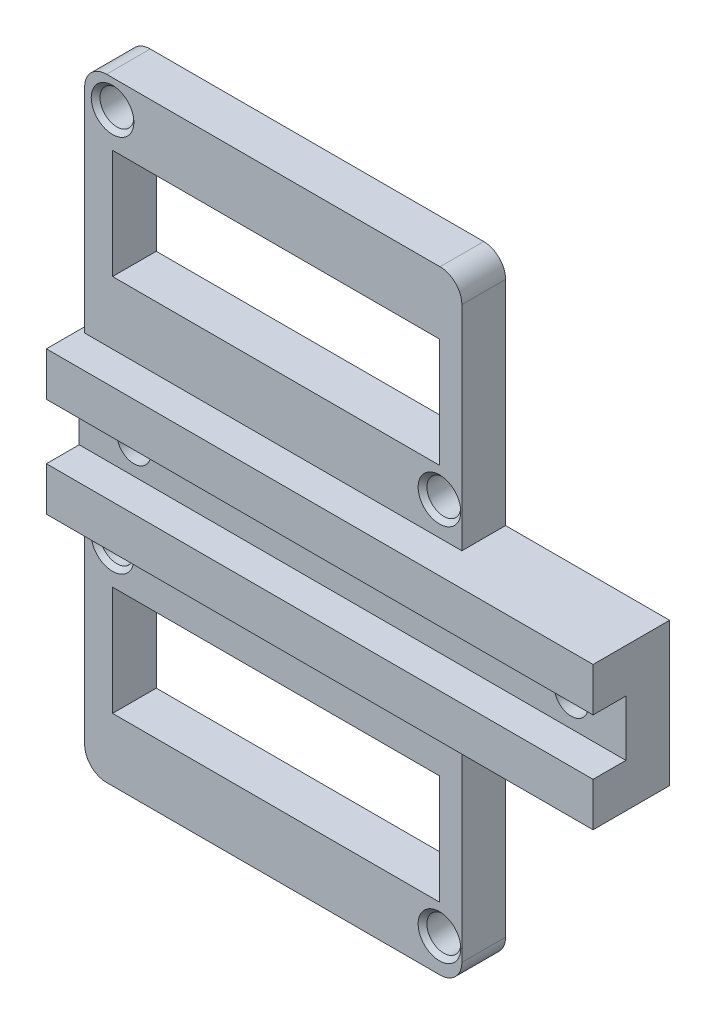
from build123d import *

# Parameters (mm, degrees)
CROQUIS1_R              = 1.55
SALIENTE_EXTRUIR1_DEPTH = 4
CROQUIS2_W              = 50
CROQUIS2_H              = 4
SALIENTE_EXTRUIR2_DEPTH = 7
SALIENTE_EXTRUIR3_START = -7
CROQUIS3_W              = 34.5
CROQUIS3_H              = 21.5
CROQUIS3_R              = 1.55
CROQUIS3_W_2            = 29.9
CROQUIS3_H_2            = 10
SALIENTE_EXTRUIR3_DEPTH = 4
REDONDEO1_R             = 2
CHAFL_N1_SIZE           = 0.4


with BuildPart() as part:
    # Croquis1 → Saliente-Extruir1 (new body)
    # profile 1 of 3: a face of its own
    with BuildSketch(Plane.XY):
        with BuildLine():
            ThreePointArc((-20, 2.55), (-22.55, 0), (-20, -2.55))
            Line((-20, -2.55), (-25, -2.55))
            Line((-25, -2.55), (-25, 2.55))
            Line((-25, 2.55), (-20, 2.55))
        make_face()
    # profile 2 of 3: a face of its own
    with BuildSketch(Plane.XY):
        with BuildLine():
            Line((-20, -2.55), (20, -2.55))
            ThreePointArc((20, -2.55), (22.55, 0), (20, 2.55))
            Line((20, 2.55), (-20, 2.55))
            ThreePointArc((-20, 2.55), (-22.55, 0), (-20, -2.55))
        make_face()
        with Locations((-20, 0)):
            Circle(CROQUIS1_R, mode=Mode.SUBTRACT)
        with Locations((20, 0)):
            Circle(CROQUIS1_R, mode=Mode.SUBTRACT)
    # profile 3 of 3: a face of its own
    with BuildSketch(Plane.XY):
        with BuildLine():
            ThreePointArc((20, -2.55), (22.55, 0), (20, 2.55))
            Line((20, 2.55), (25, 2.55))
            Line((25, 2.55), (25, -2.55))
            Line((25, -2.55), (20, -2.55))
        make_face()
    extrude(amount=SALIENTE_EXTRUIR1_DEPTH)

    # Croquis2 → Saliente-Extruir2 (add)
    with BuildSketch(Plane.XY):
        with Locations((0, 4.55)):
            Rectangle(CROQUIS2_W, CROQUIS2_H)
        with Locations((0, -4.55)):
            Rectangle(CROQUIS2_W, CROQUIS2_H)
    extrude(amount=SALIENTE_EXTRUIR2_DEPTH)

    # Croquis3 → Saliente-Extruir3 (add)
    # profile 1 of 2: a face of its own
    with BuildSketch(Plane.XY.offset(7).offset(SALIENTE_EXTRUIR3_START)):
        with Locations((-7.25, 17.3)):
            Rectangle(CROQUIS3_W, CROQUIS3_H)
        with Locations((-21.95, 25.5)):
            Circle(CROQUIS3_R, mode=Mode.SUBTRACT)
        with Locations((7.95, 9.6)):
            Circle(CROQUIS3_R, mode=Mode.SUBTRACT)
        with Locations((-7, 17.3)):
            Rectangle(CROQUIS3_W_2, CROQUIS3_H_2, mode=Mode.SUBTRACT)
    # profile 2 of 2: a face of its own
    with BuildSketch(Plane.XY.offset(7).offset(SALIENTE_EXTRUIR3_START)):
        with Locations((-7.25, -17.3)):
            Rectangle(CROQUIS3_W, CROQUIS3_H)
        with Locations((-21.95, -9.1)):
            Circle(CROQUIS3_R, mode=Mode.SUBTRACT)
        with Locations((-7, -17.3)):
            Rectangle(CROQUIS3_W_2, CROQUIS3_H_2, mode=Mode.SUBTRACT)
        with Locations((7.95, -25)):
            Circle(CROQUIS3_R, mode=Mode.SUBTRACT)
    extrude(amount=SALIENTE_EXTRUIR3_DEPTH)

    # Redondeo1
    redondeo1_edges = [part.edges().sort_by_distance(p)[0] for p in [
        (-24.5, 28.05, 2),
        (10, 28.05, 2),
        (-24.5, -28.05, 2),
        (10, -28.05, 2),
    ]]
    fillet(redondeo1_edges, radius=REDONDEO1_R)

    # Chaflán1
    chafl_n1_edges = [part.edges().sort_by_distance(p)[0] for p in [
        (-23.5, 25.5, 4),
        (6.4, 9.6, 4),
        (-23.5, -9.1, 4),
        (6.4, -25, 4),
    ]]
    chamfer(chafl_n1_edges, length=CHAFL_N1_SIZE)


solid = part.part
